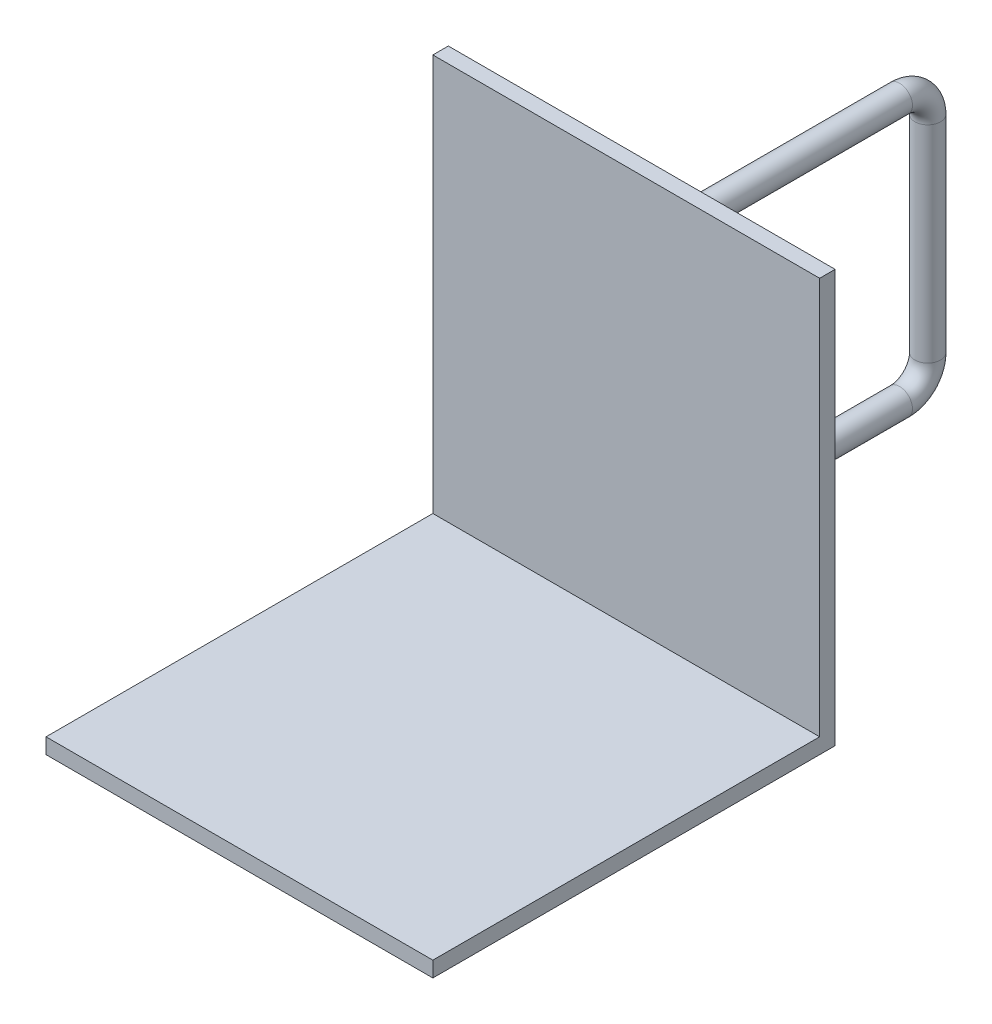
from build123d import *

# Parameters (mm, degrees)
SKETCH1_W           = 75
SKETCH1_H           = 80
BOSS_EXTRUDE1_DEPTH = 3
SKETCH2_W           = 75
SKETCH2_H           = 3
BOSS_EXTRUDE2_DEPTH = 75
SKETCH5_R           = 2.5
BOSS_EXTRUDE3_DEPTH = 3.1
SKETCH8_R           = 2.5


with BuildPart() as part:
    # Sketch1 → Boss-Extrude1 (new body)
    with BuildSketch(Plane.XY):
        with Locations((-37.5, 40)):
            Rectangle(SKETCH1_W, SKETCH1_H)
    extrude(amount=BOSS_EXTRUDE1_DEPTH)

    # Sketch2 → Boss-Extrude2 (add)
    with BuildSketch(Plane.XY.offset(3)):
        with Locations((-37.5, 1.5)):
            Rectangle(SKETCH2_W, SKETCH2_H)
    extrude(amount=BOSS_EXTRUDE2_DEPTH)

    # Sketch5 → Boss-Extrude3 (add)
    with BuildSketch(Plane.XY.offset(3)):
        with Locations((-37.5, 65)):
            Circle(SKETCH5_R)
    extrude(amount=-BOSS_EXTRUDE3_DEPTH)

    # Sweep1: sweep along a path in Sketch7
    with BuildLine(Plane(origin=(0, 0, 0), x_dir=(0, 0, -1), z_dir=(1, 0, 0))) as sweep1_path:
        Line((0, 64.541389485), (50, 64.541389485))
        ThreePointArc((50, 64.541389485), (53.535533906, 63.076923391), (55, 59.541389485))
        Line((55, 59.541389485), (55, 19.541389485))
        ThreePointArc((55, 19.541389485), (53.535533906, 16.005855579), (50, 14.541389485))
        Line((50, 14.541389485), (0, 14.541389485))
    # Sketch8 → Sweep1 (sweep)
    with BuildSketch(Plane(origin=(0, 0, -0.1), x_dir=(-1, 0, 0), z_dir=(0, 0, -1))):
        with Locations((37.5, 65)):
            Circle(SKETCH8_R)
    sweep(path=sweep1_path.line)


solid = part.part
